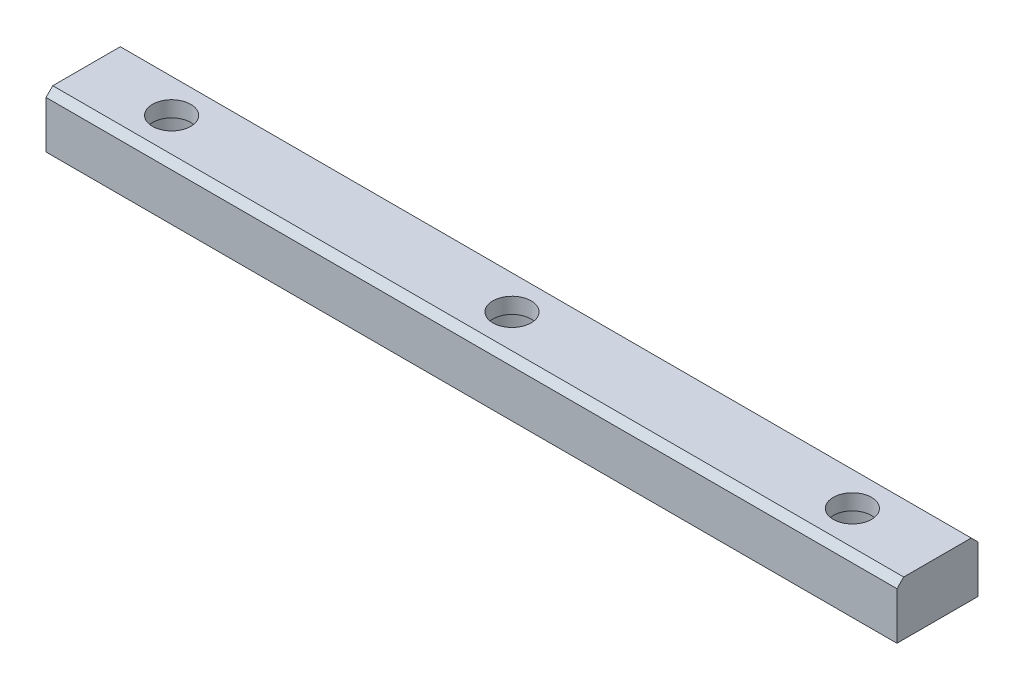
from build123d import *

# Parameters (mm, degrees)
SKETCH1_W                                           = 19.05
SKETCH1_H                                           = 12.7
BOSS_EXTRUDE1_DEPTH                                 = 100
CBORE_FOR_M8_HEX_SOCKET_HEAD_CAP_SCREW1_D           = 9
CBORE_FOR_M8_HEX_SOCKET_HEAD_CAP_SCREW1_CBORE_D     = 15
CBORE_FOR_M8_HEX_SOCKET_HEAD_CAP_SCREW1_CBORE_DEPTH = 9
CHAMFER1_SIZE                                       = 1.5875


with BuildPart() as part:
    # Sketch1 → Boss-Extrude1 (new, symmetric)
    with BuildSketch(Plane(origin=(0, 0, 0), x_dir=(0, 0, -1), z_dir=(1, 0, 0))):
        Rectangle(SKETCH1_W, SKETCH1_H)
    extrude(amount=BOSS_EXTRUDE1_DEPTH, both=True)

    # CBORE for M8 Hex Socket Head Cap Screw1 (through all)
    with Locations(Plane(origin=(-66.368908966, -6.35, -4.540102203), x_dir=(1, 0, 0), z_dir=(0, -1, 0))):
        with Locations((-13.631091034, 4.540102203), (66.368908966, 4.540102203), (146.368908966, 4.540102203)):
            CounterBoreHole(CBORE_FOR_M8_HEX_SOCKET_HEAD_CAP_SCREW1_D / 2, CBORE_FOR_M8_HEX_SOCKET_HEAD_CAP_SCREW1_CBORE_D / 2, CBORE_FOR_M8_HEX_SOCKET_HEAD_CAP_SCREW1_CBORE_DEPTH)

    # Chamfer1
    chamfer1_edges = [part.edges().sort_by_distance(p)[0] for p in [
        (0, 6.35, 9.525),
        (0, 6.35, -9.525),
    ]]
    chamfer(chamfer1_edges, length=CHAMFER1_SIZE)


solid = part.part
